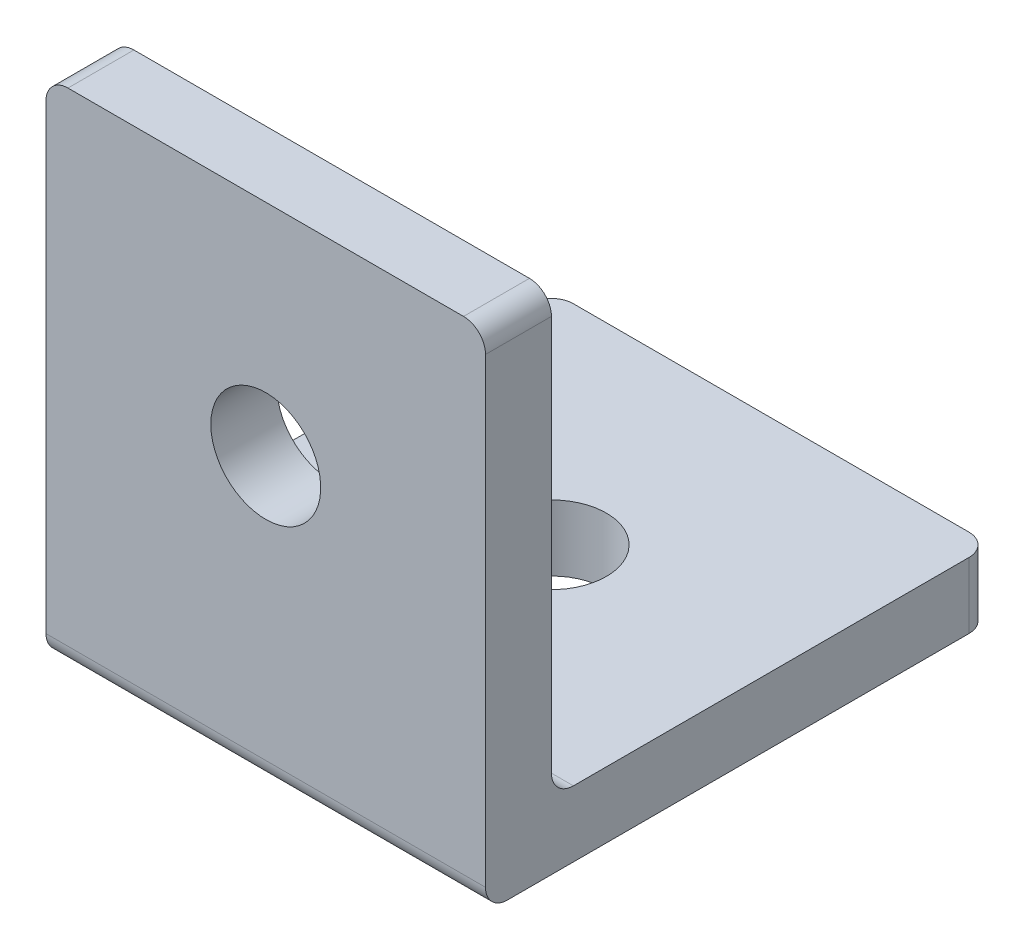
from build123d import *

# Parameters (mm, degrees)
BOSS_EXTRUDE1_DEPTH = 20
FILLET1_R           = 1
SKETCH3_R           = 2.5
CUT_EXTRUDE1_DEPTH  = 37.455452267
SKETCH4_R           = 2.5
CUT_EXTRUDE2_DEPTH  = 37.455452267


with BuildPart() as part:
    # Sketch2 → Boss-Extrude1 (new body)
    with BuildSketch(Plane(origin=(0, 0, 0), x_dir=(0, 0, -1), z_dir=(1, 0, 0))):
        with BuildLine():
            Line((1, 0), (23, 0))
            Line((23, 0), (23, 3))
            Line((23, 3), (4, 3))
            ThreePointArc((4, 3), (3.292893219, 3.292893219), (3, 4))
            Line((3, 4), (3, 23))
            Line((3, 23), (0, 23))
            Line((0, 23), (0, 1))
            ThreePointArc((0, 1), (0.292893219, 0.292893219), (1, 0))
        make_face()
    extrude(amount=-BOSS_EXTRUDE1_DEPTH)

    # Fillet1
    fillet1_edges = [part.edges().sort_by_distance(p)[0] for p in [
        (0, 1.5, -23),
        (-20, 23, -1.5),
        (-20, 1.5, -23),
        (0, 23, -1.5),
    ]]
    fillet(fillet1_edges, radius=FILLET1_R)

    # Sketch3 → Cut-Extrude1 (cut, through all)
    with BuildSketch(Plane(origin=(0, 0, -3), x_dir=(-1, 0, 0), z_dir=(0, 0, -1))):
        with Locations((10, 13)):
            Circle(SKETCH3_R)
    extrude(amount=-CUT_EXTRUDE1_DEPTH, mode=Mode.SUBTRACT)

    # Sketch4 → Cut-Extrude2 (cut, through all)
    with BuildSketch(Plane(origin=(0, 3, 0), x_dir=(1, 0, 0), z_dir=(0, 1, 0))):
        with Locations(Location((-10, 13, 0), (0, 0, 270))):
            Circle(SKETCH4_R)
    extrude(amount=-CUT_EXTRUDE2_DEPTH, mode=Mode.SUBTRACT)


solid = part.part
